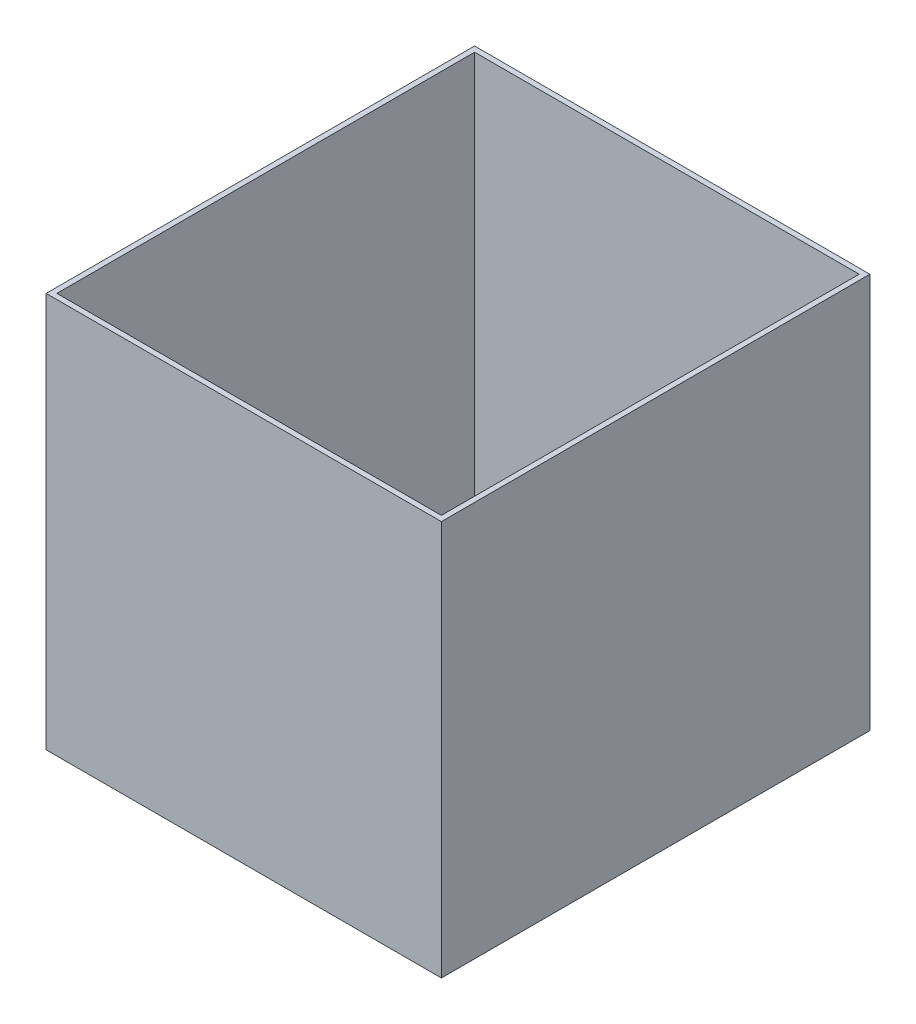
from build123d import *

# Parameters (mm, degrees)
ESQUISSE1_W        = 369
ESQUISSE1_H        = 400
BOSS_EXTRU_1_DEPTH = 369
COQUE1_T           = -5


with BuildPart() as part:
    # Esquisse1 → Boss.-Extru.1 (new body)
    with BuildSketch(Plane(origin=(0, 0, 0), x_dir=(1, 0, 0), z_dir=(0, 1, 0))):
        with Locations((184.5, 200)):
            Rectangle(ESQUISSE1_W, ESQUISSE1_H)
    extrude(amount=BOSS_EXTRU_1_DEPTH)

    # Coque1
    coque1_openings = [part.faces().sort_by_distance(p)[0] for p in [
        (184.5, 369, -200),
    ]]
    offset(amount=COQUE1_T, openings=coque1_openings, kind=Kind.INTERSECTION)


solid = part.part
